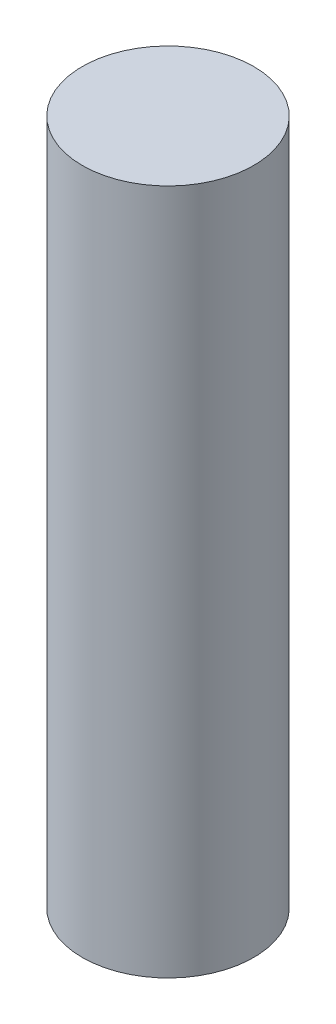
from build123d import *

# Parameters (mm, degrees)
SKETCH1_R      = 9.525
EXTRUDE1_DEPTH = 76.2


with BuildPart() as part:
    # Sketch1 → Extrude1 (new body)
    with BuildSketch(Plane(origin=(0, 0, 0), x_dir=(1, 0, 0), z_dir=(0, 1, 0))):
        with Locations(Location((0, 0, 0), (0, 0, 90))):
            Circle(SKETCH1_R)
    extrude(amount=EXTRUDE1_DEPTH)


solid = part.part
